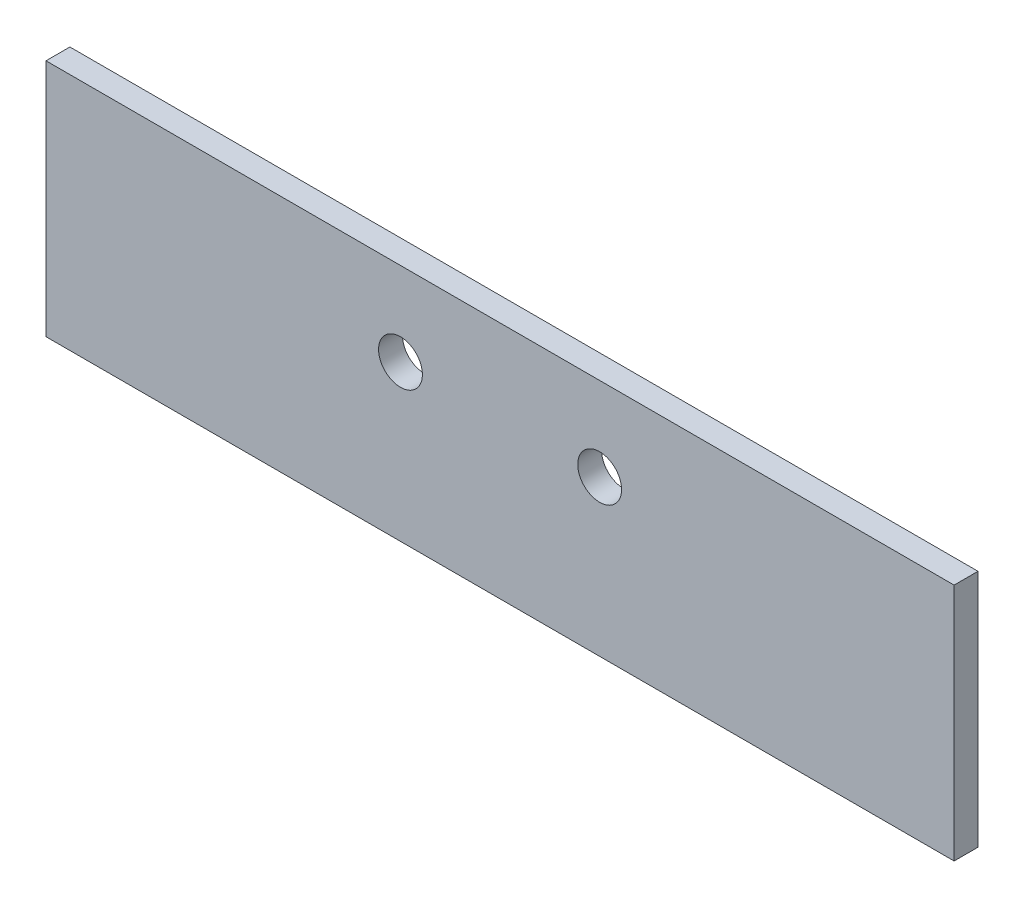
from build123d import *

# Parameters (mm, degrees)
SKETCH1_W            = 114
SKETCH1_H            = 30
BOSS_EXTRUDE1_DEPTH  = 1.5
M5_CLEARANCE_HOLE1_D = 5.5


with BuildPart() as part:
    # Sketch1 → Boss-Extrude1 (new, symmetric)
    with BuildSketch(Plane.XY):
        Rectangle(SKETCH1_W, SKETCH1_H)
    extrude(amount=BOSS_EXTRUDE1_DEPTH, both=True)

    # M5 Clearance Hole1 (through all)
    with Locations(Plane.XY.offset(1.5)):
        with Locations((-12.5, 4.5), (12.5, 4.5)):
            Hole(M5_CLEARANCE_HOLE1_D / 2)


solid = part.part
